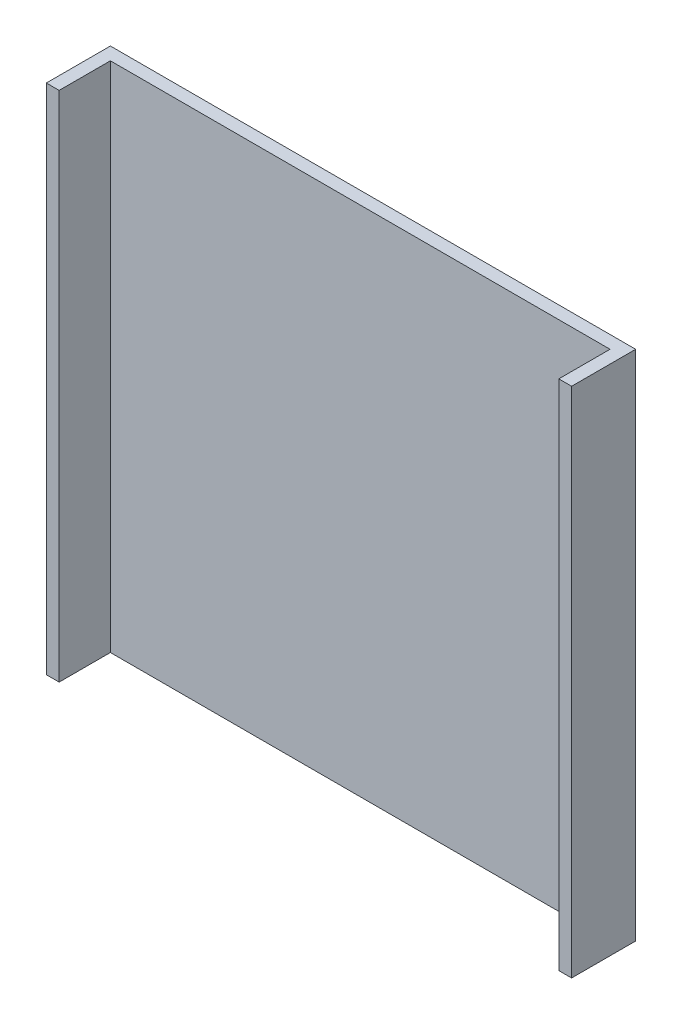
from build123d import *

# Parameters (mm, degrees)
SKETCH1_W           = 260.35
SKETCH1_H           = 254
BOSS_EXTRUDE1_DEPTH = 6.35
SKETCH2_W           = 6.35
SKETCH2_H           = 254
BOSS_EXTRUDE2_DEPTH = 25.4
SKETCH5_W           = 6.35
SKETCH5_H           = 254
BOSS_EXTRUDE4_DEPTH = 25.4


with BuildPart() as part:
    # Sketch1 → Boss-Extrude1 (new body)
    with BuildSketch(Plane.XY):
        with Locations((130.175, 127)):
            Rectangle(SKETCH1_W, SKETCH1_H)
    extrude(amount=BOSS_EXTRUDE1_DEPTH)

    # Sketch2 → Boss-Extrude2 (add)
    with BuildSketch(Plane.XY.offset(6.35)):
        with Locations((3.175, 127)):
            Rectangle(SKETCH2_W, SKETCH2_H)
    extrude(amount=BOSS_EXTRUDE2_DEPTH)

    # Sketch5 → Boss-Extrude4 (add)
    with BuildSketch(Plane.XY.offset(6.35)):
        with Locations((257.175, 127)):
            Rectangle(SKETCH5_W, SKETCH5_H)
    extrude(amount=BOSS_EXTRUDE4_DEPTH)


solid = part.part
